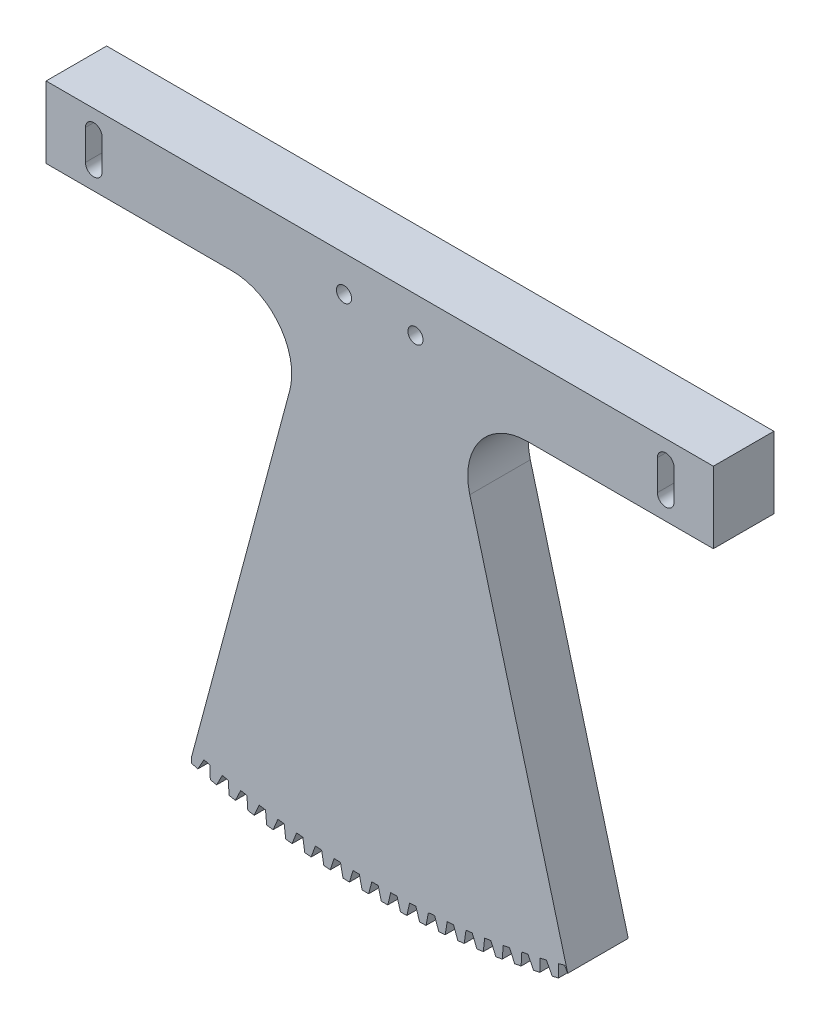
from build123d import *

# Parameters (mm, degrees)
BOSS_EXTRUDE2_DEPTH = 25.4
FILLET1_R           = 25
BOSS_EXTRUDE4_DEPTH = 25.4
CUT_EXTRUDE2_DEPTH  = 337.375088257
CIRPATTERN8_COUNT   = 20
CIRPATTERN8_ANGLE   = 28.5
SKETCH5_R           = 3.175
CUT_EXTRUDE3_DEPTH  = 339.677729262


with BuildPart() as part:
    # Sketch3 → Boss-Extrude2 (new body)
    with BuildSketch(Plane.XY):
        with BuildLine():
            Line((-140, -79.56), (-140, -109.56))
            Line((-140, -109.56), (-29.356513523, -109.56))
            Line((-29.356513523, -109.56), (-78.888044947, -294.414191853))
            ThreePointArc((-78.888044947, -294.414191853), (0, -304.8), (78.888044947, -294.414191853))
            Line((78.888044947, -294.414191853), (29.356513523, -109.56))
            Line((29.356513523, -109.56), (140, -109.56))
            Line((140, -109.56), (140, -79.56))
            Line((140, -79.56), (-140, -79.56))
        make_face()
    extrude(amount=BOSS_EXTRUDE2_DEPTH)

    # Fillet1
    fillet1_edges = [part.edges().sort_by_distance(p)[0] for p in [
        (29.356513523, -109.56, 12.7),
        (-29.356513523, -109.56, 12.7),
    ]]
    fillet(fillet1_edges, radius=FILLET1_R)

    # Sketch14 → Boss-Extrude4 (add)
    with BuildSketch(Plane(origin=(0, 0, 0), x_dir=(-1, 0, 0), z_dir=(0, 0, -1))):
        with BuildLine():
            Line((78.910933272, -297.036934084), (78.888044947, -294.414191853))
            ThreePointArc((78.888044947, -294.414191853), (76.959432674, -294.924203351), (75.027523715, -295.421581279))
            Line((75.027523715, -295.421581279), (76.289081309, -297.721097125))
            Line((76.289081309, -297.721097125), (78.910933272, -297.036934084))
        make_face()
    boss_extrude4 = extrude(amount=-BOSS_EXTRUDE4_DEPTH)

    # Sketch16 → Cut-Extrude2 (cut, symmetric)
    with BuildSketch(Plane(origin=(0, 0, 0), x_dir=(-1, 0, 0), z_dir=(0, 0, -1))):
        Polygon((372.937709596, -838.440145613), (75.027523715, -295.421581279), (73.765262731, -293.12078332), (71.19993834, -293.754449124), (71.154137831, -296.378353915), (60.344615656, -915.654378233), (357.400151379, -2118.250141136), (669.993245319, -2041.035908516), align=None)
    cut_extrude2 = extrude(amount=CUT_EXTRUDE2_DEPTH, both=True, mode=Mode.SUBTRACT)

    # CirPattern8: Boss-Extrude4, Cut-Extrude2 ×20 about axis
    cirpattern8_axis = Axis((0, 0, 0), (0, 0, 1))
    add([boss_extrude4.rotate(cirpattern8_axis, i * CIRPATTERN8_ANGLE / (CIRPATTERN8_COUNT - 1)) for i in range(1, CIRPATTERN8_COUNT)])
    add([cut_extrude2.rotate(cirpattern8_axis, i * CIRPATTERN8_ANGLE / (CIRPATTERN8_COUNT - 1)) for i in range(1, CIRPATTERN8_COUNT)], mode=Mode.SUBTRACT)

    # Sketch5 → Cut-Extrude3 (cut, through all)
    with BuildSketch(Plane(origin=(0, 0, 0), x_dir=(-1, 0, 0), z_dir=(0, 0, -1))):
        with Locations((-15, -94.56)):
            Circle(SKETCH5_R)
        with Locations((15, -94.56)):
            Circle(SKETCH5_R)
        with BuildLine():
            Line((-123.5, -94.56), (-123.5, -100.91))
            ThreePointArc((-123.5, -100.91), (-120, -104.41), (-116.5, -100.91))
            Line((-116.5, -100.91), (-116.5, -94.56))
            Line((-116.5, -94.56), (-116.5, -88.21))
            ThreePointArc((-116.5, -88.21), (-120, -84.71), (-123.5, -88.21))
            Line((-123.5, -88.21), (-123.5, -94.56))
        make_face()
        with BuildLine():
            Line((116.5, -94.56), (116.5, -88.21))
            ThreePointArc((116.5, -88.21), (120, -84.71), (123.5, -88.21))
            Line((123.5, -88.21), (123.5, -94.56))
            Line((123.5, -94.56), (123.5, -100.91))
            ThreePointArc((123.5, -100.91), (120, -104.41), (116.5, -100.91))
            Line((116.5, -100.91), (116.5, -94.56))
        make_face()
    extrude(amount=-CUT_EXTRUDE3_DEPTH, mode=Mode.SUBTRACT)


solid = part.part
